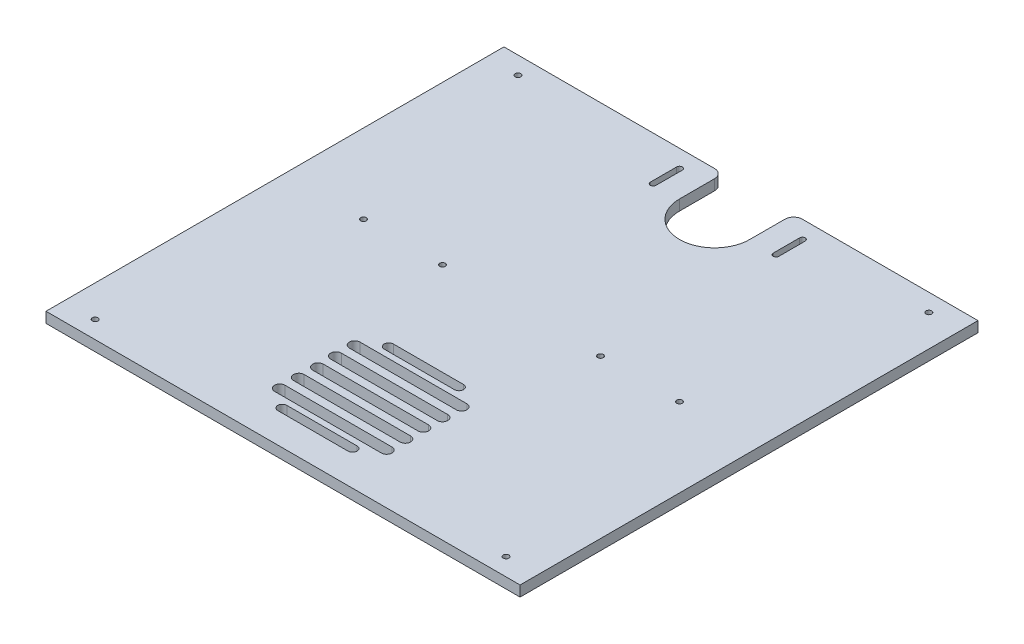
from build123d import *

# Parameters (mm, degrees)
SKETCH1_R               = 1.6
BOSS_EXTRUDE1_DEPTH     = 6
CUT_EXTRUDE1_DEPTH      = 203.20197823
CUT_EXTRUDE1_DEPTH_BACK = 203.20197823
SKETCH4_R               = 1.6
CUT_EXTRUDE2_DEPTH      = 10
CUT_EXTRUDE3_DEPTH      = 10
FILLET1_R               = 5
CUT_EXTRUDE4_DEPTH      = 10
CUT_EXTRUDE4_DEPTH_BACK = 10


with BuildPart() as part:
    # Sketch1 → Boss-Extrude1 (new body)
    with BuildSketch(Plane(origin=(0, 0, 0), x_dir=(1, 0, 0), z_dir=(0, 1, 0))):
        Polygon((-145, 120), (125, 120), (125, -100.8), (125, -140.8), (-145, -140.8), (-145, -100.8), align=None)
        with Locations((-100, -5)):
            Circle(SKETCH1_R, mode=Mode.SUBTRACT)
        with Locations((80, -5)):
            Circle(SKETCH1_R, mode=Mode.SUBTRACT)
        with Locations((-55, -5)):
            Circle(SKETCH1_R, mode=Mode.SUBTRACT)
        with Locations((35, -5)):
            Circle(SKETCH1_R, mode=Mode.SUBTRACT)
    extrude(amount=BOSS_EXTRUDE1_DEPTH)

    # Sketch3 → Cut-Extrude1 (cut, two sides: drawn at the far end of the back side and taken through both)
    with BuildSketch(Plane(origin=(0, 6, 0), x_dir=(1, 0, 0), z_dir=(0, 1, 0)).offset(-CUT_EXTRUDE1_DEPTH_BACK)):
        with BuildLine():
            Line((-20, 95), (-20, 120))
            Line((-20, 120), (20, 120))
            Line((20, 120), (20, 95))
            ThreePointArc((20, 95), (0, 75), (-20, 95))
        make_face()
    extrude(amount=CUT_EXTRUDE1_DEPTH + CUT_EXTRUDE1_DEPTH_BACK, mode=Mode.SUBTRACT)

    # Sketch4 → Cut-Extrude2 (cut)
    with BuildSketch(Plane.XZ):
        with Locations((107, -110)):
            Circle(SKETCH4_R)
        with Locations((-127, -110)):
            Circle(SKETCH4_R)
        with Locations((107, 130.8)):
            Circle(SKETCH4_R)
        with Locations((-127, 130.8)):
            Circle(SKETCH4_R)
    extrude(amount=-CUT_EXTRUDE2_DEPTH, mode=Mode.SUBTRACT)

    # Sketch5 → Cut-Extrude3 (cut)
    with BuildSketch(Plane(origin=(0, 6, 0), x_dir=(1, 0, 0), z_dir=(0, 1, 0))):
        with BuildLine():
            Line((-33.4, 110), (-33.4, 95))
            ThreePointArc((-33.4, 95), (-35, 93.4), (-36.6, 95))
            Line((-36.6, 95), (-36.6, 110))
            ThreePointArc((-36.6, 110), (-35, 111.6), (-33.4, 110))
        make_face()
        with BuildLine():
            Line((33.4, 110), (33.4, 95))
            ThreePointArc((33.4, 95), (35, 93.4), (36.6, 95))
            Line((36.6, 95), (36.6, 110))
            ThreePointArc((36.6, 110), (35, 111.6), (33.4, 110))
        make_face()
    extrude(amount=-CUT_EXTRUDE3_DEPTH, mode=Mode.SUBTRACT)

    # Fillet1
    fillet1_edges = [part.edges().sort_by_distance(p)[0] for p in [
        (20, 3, -120),
        (-20, 3, -120),
    ]]
    fillet(fillet1_edges, radius=FILLET1_R)

    # Sketch6 → Cut-Extrude4 (cut, two sides: drawn at the far end of the back side and taken through both)
    with BuildSketch(Plane.XZ.offset(-CUT_EXTRUDE4_DEPTH_BACK)):
        with BuildLine():
            Line((10, 58.021465569), (-30, 58.021465569))
            ThreePointArc((-30, 58.021465569), (-32.570860459, 60.592326028), (-30, 63.163186487))
            Line((-30, 63.163186487), (10, 63.163186487))
            ThreePointArc((10, 63.163186487), (12.570860459, 60.592326028), (10, 58.021465569))
        make_face()
        with BuildLine():
            Line((20.436008981, 66.571059525), (-40.436008981, 66.571059525))
            ThreePointArc((-40.436008981, 66.571059525), (-43.436008981, 69.571059525), (-40.436008981, 72.571059525))
            Line((-40.436008981, 72.571059525), (20.436008981, 72.571059525))
            ThreePointArc((20.436008981, 72.571059525), (23.436008981, 69.571059525), (20.436008981, 66.571059525))
        make_face()
        with BuildLine():
            Line((20.316760433, 77.325947728), (-40.316760433, 77.325947728))
            ThreePointArc((-40.316760433, 77.325947728), (-43.316760433, 80.325947728), (-40.316760433, 83.325947728))
            Line((-40.316760433, 83.325947728), (20.316760433, 83.325947728))
            ThreePointArc((20.316760433, 83.325947728), (23.316760433, 80.325947728), (20.316760433, 77.325947728))
        make_face()
        with BuildLine():
            Line((-30, 123.777281933), (10, 123.777281933))
            ThreePointArc((10, 123.777281933), (12.570860459, 121.206421475), (10, 118.635561016))
            Line((10, 118.635561016), (-30, 118.635561016))
            ThreePointArc((-30, 118.635561016), (-32.570860459, 121.206421475), (-30, 123.777281933))
        make_face()
        with BuildLine():
            Line((-40.436008981, 115.227687978), (20.436008981, 115.227687978))
            ThreePointArc((20.436008981, 115.227687978), (23.436008981, 112.227687978), (20.436008981, 109.227687978))
            Line((20.436008981, 109.227687978), (-40.436008981, 109.227687978))
            ThreePointArc((-40.436008981, 109.227687978), (-43.436008981, 112.227687978), (-40.436008981, 115.227687978))
        make_face()
        with BuildLine():
            Line((-40.316760433, 104.472799775), (20.316760433, 104.472799775))
            ThreePointArc((20.316760433, 104.472799775), (23.316760433, 101.472799775), (20.316760433, 98.472799775))
            Line((20.316760433, 98.472799775), (-40.316760433, 98.472799775))
            ThreePointArc((-40.316760433, 98.472799775), (-43.316760433, 101.472799775), (-40.316760433, 104.472799775))
        make_face()
        with BuildLine():
            Line((20, 87.899373751), (-40, 87.899373751))
            ThreePointArc((-40, 87.899373751), (-43, 90.899373751), (-40, 93.899373751))
            Line((-40, 93.899373751), (20, 93.899373751))
            ThreePointArc((20, 93.899373751), (23, 90.899373751), (20, 87.899373751))
        make_face()
    extrude(amount=CUT_EXTRUDE4_DEPTH + CUT_EXTRUDE4_DEPTH_BACK, mode=Mode.SUBTRACT)


solid = part.part
